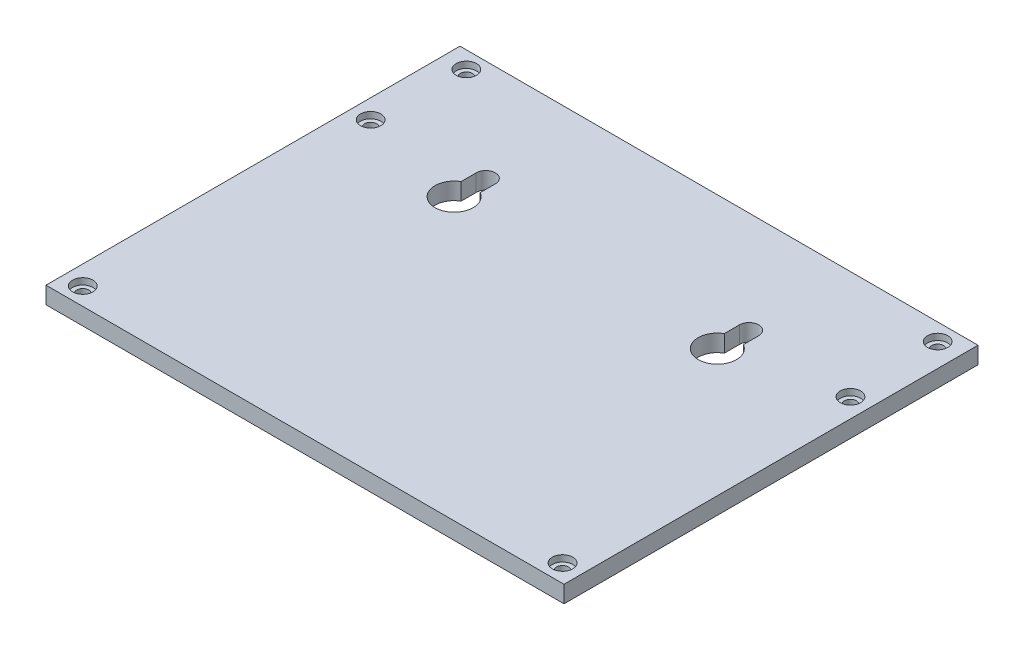
from build123d import *

# Parameters (mm, degrees)
SKETCH1_W           = 122
SKETCH1_H           = 97.5
BOSS_EXTRUDE1_DEPTH = 4
SKETCH2_R           = 1.4
CUT_EXTRUDE1_DEPTH  = 4
SKETCH3_R           = 2.4
CUT_EXTRUDE2_DEPTH  = 1.5
CUT_EXTRUDE3_DEPTH  = 4


with BuildPart() as part:
    # Sketch1 → Boss-Extrude1 (new body)
    with BuildSketch(Plane(origin=(0, 0, 0), x_dir=(1, 0, 0), z_dir=(0, 1, 0))):
        with Locations((-30.40625, -8.671875)):
            Rectangle(SKETCH1_W, SKETCH1_H)
    extrude(amount=BOSS_EXTRUDE1_DEPTH)

    # Sketch2 → Cut-Extrude1 (cut)
    with BuildSketch(Plane(origin=(0, 4, 0), x_dir=(1, 0, 0), z_dir=(0, 1, 0))):
        with Locations(Location((-86.90625, -53.261875, 0), (0, 0, 270))):
            Circle(SKETCH2_R)
        with Locations(Location((-86.90625, 14.538125, 0), (0, 0, 270))):
            Circle(SKETCH2_R)
        with Locations(Location((26.09375, 14.538125, 0), (0, 0, 270))):
            Circle(SKETCH2_R)
        with Locations(Location((26.09375, -53.261875, 0), (0, 0, 270))):
            Circle(SKETCH2_R)
        with Locations(Location((-85.90625, 36.078125, 0), (0, 0, 270))):
            Circle(SKETCH2_R)
        with Locations(Location((25.09375, 36.078125, 0), (0, 0, 270))):
            Circle(SKETCH2_R)
    extrude(amount=-CUT_EXTRUDE1_DEPTH, mode=Mode.SUBTRACT)

    # Sketch3 → Cut-Extrude2 (cut)
    with BuildSketch(Plane(origin=(0, 4, 0), x_dir=(1, 0, 0), z_dir=(0, 1, 0))):
        with Locations(Location((-86.90625, 14.538125, 0), (0, 0, 270))):
            Circle(SKETCH3_R)
        with Locations(Location((-86.90625, -53.261875, 0), (0, 0, 270))):
            Circle(SKETCH3_R)
        with Locations(Location((26.09375, -53.261875, 0), (0, 0, 270))):
            Circle(SKETCH3_R)
        with Locations(Location((26.09375, 14.538125, 0), (0, 0, 270))):
            Circle(SKETCH3_R)
        with Locations(Location((-85.90625, 36.078125, 0), (0, 0, 270))):
            Circle(SKETCH3_R)
        with Locations(Location((25.09375, 36.078125, 0), (0, 0, 270))):
            Circle(SKETCH3_R)
    extrude(amount=-CUT_EXTRUDE2_DEPTH, mode=Mode.SUBTRACT)

    # Sketch4 → Cut-Extrude3 (cut)
    with BuildSketch(Plane(origin=(0, 4, 0), x_dir=(1, 0, 0), z_dir=(0, 1, 0))):
        with BuildLine():
            Line((-1.65625, 16.157315761), (-1.65625, 12.586287383))
            ThreePointArc((-1.65625, 12.586287383), (0.59375, 4.18990801), (2.84375, 12.586287383))
            Line((2.84375, 12.586287383), (2.84375, 16.157315761))
            ThreePointArc((2.84375, 16.157315761), (0.59375, 18.407315761), (-1.65625, 16.157315761))
        make_face()
        with BuildLine():
            Line((-63.65625, 16.157315761), (-63.65625, 12.586287383))
            ThreePointArc((-63.65625, 12.586287383), (-61.40625, 4.18990801), (-59.15625, 12.586287383))
            Line((-59.15625, 12.586287383), (-59.15625, 16.157315761))
            ThreePointArc((-59.15625, 16.157315761), (-61.40625, 18.407315761), (-63.65625, 16.157315761))
        make_face()
    extrude(amount=-CUT_EXTRUDE3_DEPTH, mode=Mode.SUBTRACT)


solid = part.part
